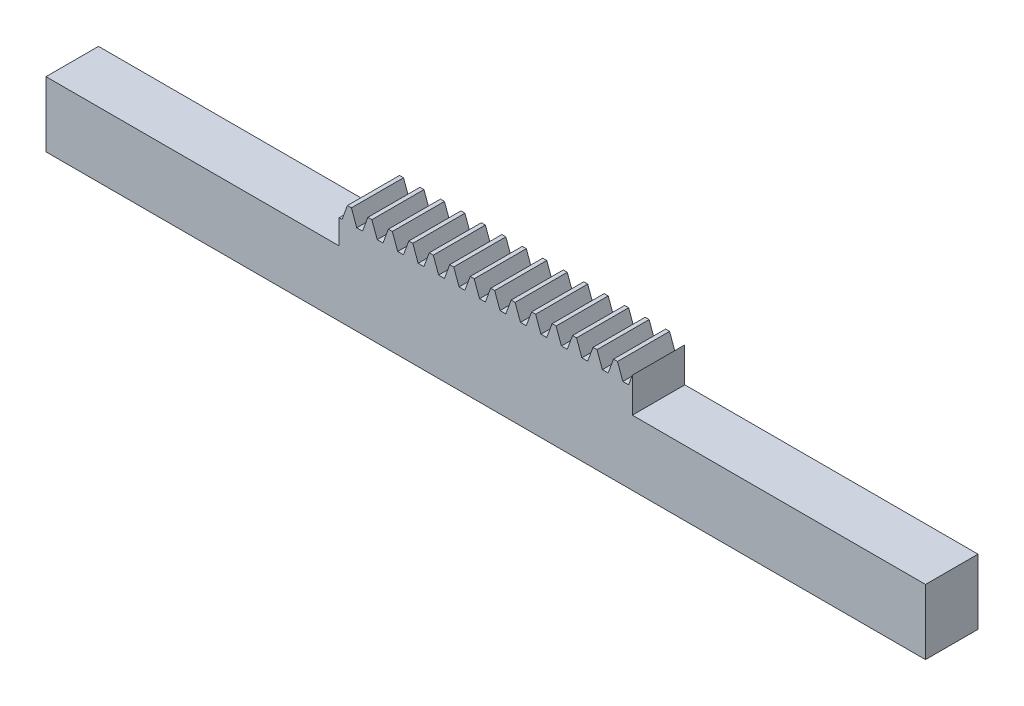
from build123d import *

# Parameters (mm, degrees)
BOSS_EXTRUDE1_DEPTH = 8
SKETCH2_W           = 135
SKETCH2_H           = 8.056190957
BOSS_EXTRUDE2_DEPTH = 10


with BuildPart() as part:
    # Sketch1 → Boss-Extrude1 (new body)
    with BuildSketch(Plane(origin=(0, 0, -3.792826984), x_dir=(-1, 0, 0), z_dir=(0, 0, -1))):
        Polygon((23.516961809, -6.40864854), (22.698028781, -8.65864854), (21.809158042, -8.65864854), (21.235890512, -7.083608945), (21.235890512, -12.40864854), (66.235890512, -12.40864854), (66.235890512, -8.65864854), (65.791455142, -8.65864854), (64.972522115, -6.40864854), (64.357666259, -6.40864854), (63.538733231, -8.65864854), (62.649862492, -8.65864854), (61.830929465, -6.40864854), (61.216073609, -6.40864854), (60.397140581, -8.65864854), (59.508269842, -8.65864854), (58.689336815, -6.40864854), (58.074480959, -6.40864854), (57.255547931, -8.65864854), (56.366677192, -8.65864854), (55.547744165, -6.40864854), (54.932888309, -6.40864854), (54.113955281, -8.65864854), (53.225084542, -8.65864854), (52.406151515, -6.40864854), (51.791295659, -6.40864854), (50.972362631, -8.65864854), (50.083491892, -8.65864854), (49.264558865, -6.40864854), (48.649703009, -6.40864854), (47.830769981, -8.65864854), (46.941899242, -8.65864854), (46.122966215, -6.40864854), (45.508110359, -6.40864854), (44.689177331, -8.65864854), (43.800306592, -8.65864854), (42.981373565, -6.40864854), (42.366517709, -6.40864854), (41.547584681, -8.65864854), (40.658713942, -8.65864854), (39.839780915, -6.40864854), (39.224925059, -6.40864854), (38.405992031, -8.65864854), (37.517121292, -8.65864854), (36.698188265, -6.40864854), (36.083332409, -6.40864854), (35.264399381, -8.65864854), (34.375528642, -8.65864854), (33.556595615, -6.40864854), (32.941739759, -6.40864854), (32.122806731, -8.65864854), (31.233935992, -8.65864854), (30.415002965, -6.40864854), (29.800147109, -6.40864854), (28.981214081, -8.65864854), (28.092343342, -8.65864854), (27.273410315, -6.40864854), (26.658554459, -6.40864854), (25.839621431, -8.65864854), (24.950750692, -8.65864854), (24.131817665, -6.40864854), align=None)
    extrude(amount=-BOSS_EXTRUDE1_DEPTH)

    # Sketch2 → Boss-Extrude2 (add)
    with BuildSketch(Plane.XZ.offset(12.40864854)):
        with Locations((-43.735890512, 0.179077538)):
            Rectangle(SKETCH2_W, SKETCH2_H)
    extrude(amount=BOSS_EXTRUDE2_DEPTH)


solid = part.part
